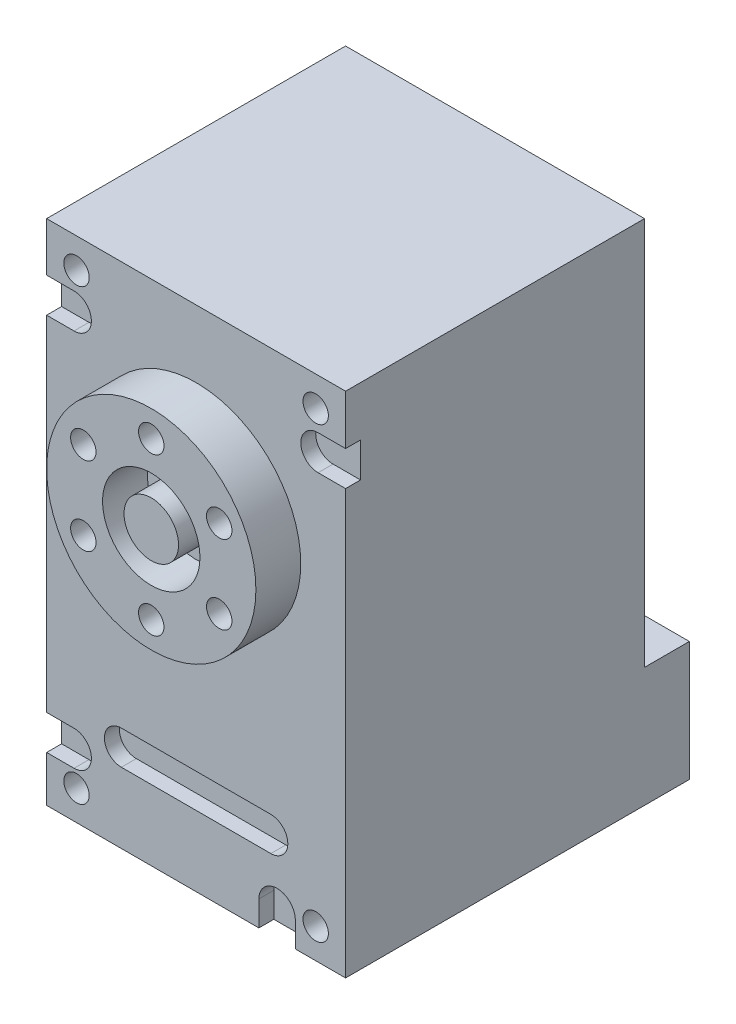
from build123d import *

# Parameters (mm, degrees)
SKETCH_1_R          = 7
SKETCH_1_R_2        = 0.850353778
SKETCH_1_R_3        = 3.257524386
EXTRUDE_4_DEPTH     = 3
SKETCH_1_R_4        = 1.823169144
EXTRUDE_4_2_DEPTH   = 3
SKETCH_1_9_W        = 20
SKETCH_1_9_H        = 34
EXTRUDE_5_DEPTH     = 20
SKETCH_7_R          = 0.85
CUT_EXTRUDE_1_DEPTH = 1.5
SKETCH_8_W          = 3
SKETCH_8_H          = 8
EXTRUDE_6_DEPTH     = 20
EXTRUDE_7_DEPTH     = 20
CUT_EXTRUDE_2_DEPTH = 4.5
CUT_EXTRUDE_3_DEPTH = 4.5
EXTRUDE_START       = 3
SKETCH_14_R         = 7
SKETCH_14_R_2       = 0.850353778
SKETCH_14_R_3       = 3.257524386
SKETCH_14_R_4       = 1.823169144
EXTRUDE_8_DEPTH     = 3
CUT_EXTRUDE_4_DEPTH = 1


with BuildPart() as part:
    # 草图1 → 凸台-拉伸4 (new body)
    with BuildSketch(Plane.XY):
        with Locations((10, 22.5)):
            Circle(SKETCH_1_R)
        with Locations((10, 27.75)):
            Circle(SKETCH_1_R_2, mode=Mode.SUBTRACT)
        with Locations((5.45336663, 25.125)):
            Circle(SKETCH_1_R_2, mode=Mode.SUBTRACT)
        with Locations((5.45336663, 19.875)):
            Circle(SKETCH_1_R_2, mode=Mode.SUBTRACT)
        with Locations((10, 17.25)):
            Circle(SKETCH_1_R_2, mode=Mode.SUBTRACT)
        with Locations((14.54663337, 19.875)):
            Circle(SKETCH_1_R_2, mode=Mode.SUBTRACT)
        with Locations((14.54663337, 25.125)):
            Circle(SKETCH_1_R_2, mode=Mode.SUBTRACT)
        with Locations((10, 22.5)):
            Circle(SKETCH_1_R_3, mode=Mode.SUBTRACT)
    extrude(amount=EXTRUDE_4_DEPTH)



with BuildPart() as body_2:
    # 草图1 → Extrude 4 2 (new body)
    with BuildSketch(Plane.XY):
        with Locations((10, 22.5)):
            Circle(SKETCH_1_R_4)
    extrude(amount=EXTRUDE_4_2_DEPTH)


with BuildPart() as part_1:
    add(part.part)

    add(body_2.part)  # 凸台-拉伸5 merges body 2
    # 草图1<9> → 凸台-拉伸5 (add)
    with BuildSketch(Plane.XY):
        with Locations((10, 17)):
            Rectangle(SKETCH_1_9_W, SKETCH_1_9_H)
    extrude(amount=-EXTRUDE_5_DEPTH)

    # 草图7 → 切除-拉伸1 (cut)
    with BuildSketch(Plane.XY):
        with Locations((2, 32)):
            Circle(SKETCH_7_R)
        with Locations((18, 32)):
            Circle(SKETCH_7_R)
        with Locations((18, 2)):
            Circle(SKETCH_7_R)
        with Locations((2, 2)):
            Circle(SKETCH_7_R)
    extrude(amount=-CUT_EXTRUDE_1_DEPTH, mode=Mode.SUBTRACT)

    # 草图8 → 凸台-拉伸6 (add)
    with BuildSketch(Plane.ZY):
        with Locations((-21.5, 4)):
            Rectangle(SKETCH_8_W, SKETCH_8_H)
    extrude(amount=-EXTRUDE_6_DEPTH)

    # 草图11 → 凸台-拉伸7 (add)
    with BuildSketch(Plane.ZY):
        Polygon((-23, 8), (-20, 15), (-20, 8), align=None)
    extrude(amount=-EXTRUDE_7_DEPTH)

    # 草图12 → 切除-拉伸2 (cut)
    with BuildSketch(Plane.ZY):
        Polygon((-23, 8), (-20, 8), (-20, 15), align=None)
    extrude(amount=-CUT_EXTRUDE_2_DEPTH, mode=Mode.SUBTRACT)

    # 草图13 → 切除-拉伸3 (cut)
    with BuildSketch(Plane(origin=(20, 0, 0), x_dir=(0, 0, -1), z_dir=(1, 0, 0))):
        Polygon((23, 8), (20, 8), (20, 15), align=None)
    extrude(amount=-CUT_EXTRUDE_3_DEPTH, mode=Mode.SUBTRACT)

    # 草图14 → 凸台-拉伸8 (add)
    # profile 1 of 2: a face of its own
    with BuildSketch(Plane(origin=(0, 0, -20), x_dir=(-1, 0, 0), z_dir=(0, 0, -1)).offset(EXTRUDE_START)):
        with Locations((-10, 22.5)):
            Circle(SKETCH_14_R)
        with Locations((-10, 27.75)):
            Circle(SKETCH_14_R_2, mode=Mode.SUBTRACT)
        with Locations((-14.54663337, 25.125)):
            Circle(SKETCH_14_R_2, mode=Mode.SUBTRACT)
        with Locations((-14.54663337, 19.875)):
            Circle(SKETCH_14_R_2, mode=Mode.SUBTRACT)
        with Locations((-10, 17.25)):
            Circle(SKETCH_14_R_2, mode=Mode.SUBTRACT)
        with Locations((-5.45336663, 19.875)):
            Circle(SKETCH_14_R_2, mode=Mode.SUBTRACT)
        with Locations((-5.45336663, 25.125)):
            Circle(SKETCH_14_R_2, mode=Mode.SUBTRACT)
        with Locations((-10, 22.5)):
            Circle(SKETCH_14_R_3, mode=Mode.SUBTRACT)
    # profile 2 of 2: a face of its own
    with BuildSketch(Plane(origin=(0, 0, -20), x_dir=(-1, 0, 0), z_dir=(0, 0, -1)).offset(EXTRUDE_START)):
        with Locations((-10, 22.5)):
            Circle(SKETCH_14_R_4)
    extrude(amount=-EXTRUDE_8_DEPTH)

    # 草图15 → 切除-拉伸4 (cut)
    with BuildSketch(Plane.XY):
        with BuildLine():
            Line((14.199925624, -0.313660731), (14.199925624, 1.680989497))
            ThreePointArc((14.199925624, 1.680989497), (15.418680846, 2.899744718), (16.637436067, 1.680989497))
            Line((16.637436067, 1.680989497), (16.637436067, -0.313660731))
            ThreePointArc((16.637436067, -0.313660731), (15.418680846, -1.532415952), (14.199925624, -0.313660731))
        make_face()
        with BuildLine():
            Line((0, 5.38672918), (1.833474719, 5.38672918))
            ThreePointArc((1.833474719, 5.38672918), (2.992727253, 4.227476646), (1.833474719, 3.068224113))
            Line((1.833474719, 3.068224113), (0, 3.068224113))
            ThreePointArc((0, 3.068224113), (-1.159252534, 4.227476646), (0, 5.38672918))
        make_face()
        with BuildLine():
            Line((-0.001085169, 30.723461602), (1.83238955, 30.723461602))
            ThreePointArc((1.83238955, 30.723461602), (2.991642084, 29.564209068), (1.83238955, 28.404956534))
            Line((1.83238955, 28.404956534), (-0.001085169, 28.404956534))
            ThreePointArc((-0.001085169, 28.404956534), (-1.160337702, 29.564209068), (-0.001085169, 30.723461602))
        make_face()
        with BuildLine():
            Line((18.162139599, 30.675155153), (19.995614318, 30.675155153))
            ThreePointArc((19.995614318, 30.675155153), (21.154866852, 29.515902619), (19.995614318, 28.356650085))
            Line((19.995614318, 28.356650085), (18.162139599, 28.356650085))
            ThreePointArc((18.162139599, 28.356650085), (17.002887065, 29.515902619), (18.162139599, 30.675155153))
        make_face()
        with BuildLine():
            Line((5, 6.980944231), (15, 6.980944231))
            ThreePointArc((15, 6.980944231), (16.135201548, 5.845742683), (15, 4.710541135))
            Line((15, 4.710541135), (5, 4.710541135))
            ThreePointArc((5, 4.710541135), (3.864798452, 5.845742683), (5, 6.980944231))
        make_face()
    extrude(amount=-CUT_EXTRUDE_4_DEPTH, mode=Mode.SUBTRACT)


solid = part_1.part
